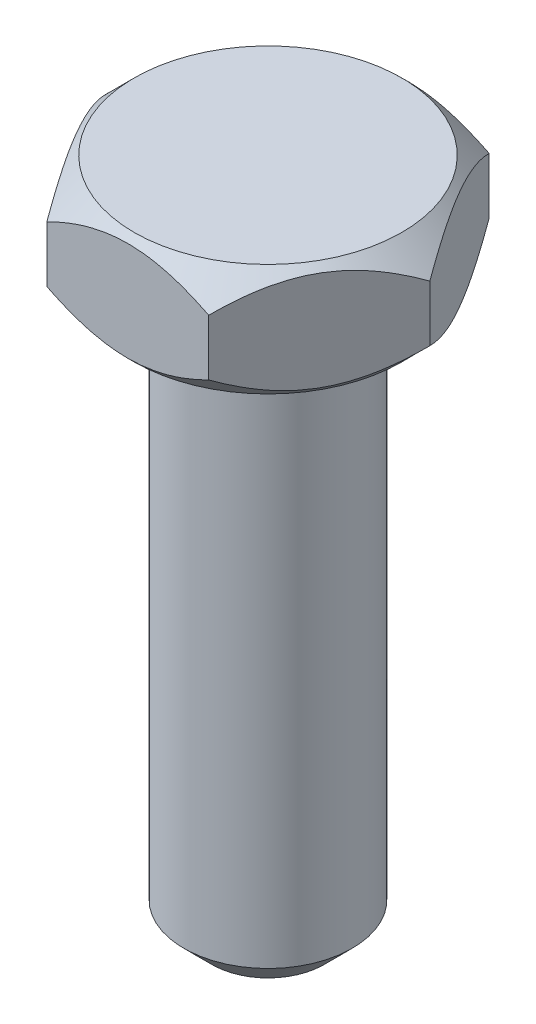
from build123d import *

# Parameters (mm, degrees)
EXTRUDE_1_DEPTH = 4
SKETCH_2_R      = 3
EXTRUDE_2_DEPTH = 20
CHAMFER_2_SIZE  = 1


with BuildPart() as part:
    # Эскиз1 → Вытянуть1 (new body)
    with BuildSketch(Plane(origin=(0, 0, 0), x_dir=(1, 0, 0), z_dir=(0, 1, 0))):
        Polygon((-2.886751346, 5), (2.886751346, 5), (5.773502692, 0), (2.886751346, -5), (-2.886751346, -5), (-5.773502692, 0), align=None)
    extrude(amount=-EXTRUDE_1_DEPTH)

    # Эскиз2 → Вытянуть2 (add)
    with BuildSketch(Plane.XZ.offset(4)):
        with Locations(Location((0, 0, 0), (0, 0, 270))):
            Circle(SKETCH_2_R)
    extrude(amount=EXTRUDE_2_DEPTH)

    # Фаска2
    chamfer_2_edges = [part.edges().sort_by_distance(p)[0] for p in [
        (0, -24, 3),
    ]]
    chamfer(chamfer_2_edges, length=CHAMFER_2_SIZE)

    # Эскиз3 → Вырез-Повернуть1 (revolve, cut)
    with BuildSketch(Plane.XY, mode=Mode.PRIVATE) as cut_revolve_1_sk:
        Polygon((-5.773502692, -1), (-4.773502692, 0), (-5.773502692, 0), align=None)
        Polygon((-5.773502692, -3), (-4.773502692, -4), (-5.773502692, -4), align=None)
    revolve(cut_revolve_1_sk.sketch.rotate(Axis((0, -4, 0), (0, -1, 0)), 270), axis=Axis((0, -4, 0), (0, -1, 0)), mode=Mode.SUBTRACT)


solid = part.part
